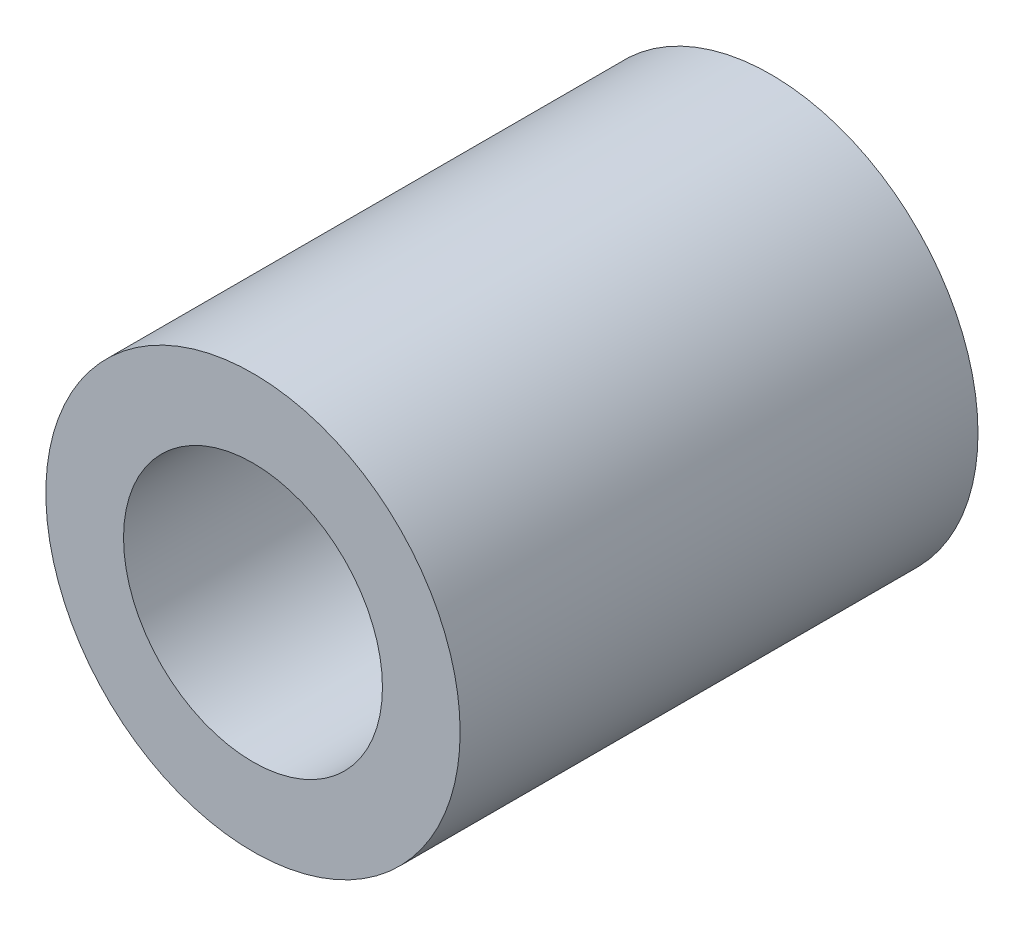
from build123d import *

# Parameters (mm, degrees)
SKETCH1_R           = 4
SKETCH1_R_2         = 2.5
BOSS_EXTRUDE1_DEPTH = 10


with BuildPart() as part:
    # Sketch1 → Boss-Extrude1 (new body)
    with BuildSketch(Plane.XY):
        Circle(SKETCH1_R)
        Circle(SKETCH1_R_2, mode=Mode.SUBTRACT)
    extrude(amount=BOSS_EXTRUDE1_DEPTH)


solid = part.part
